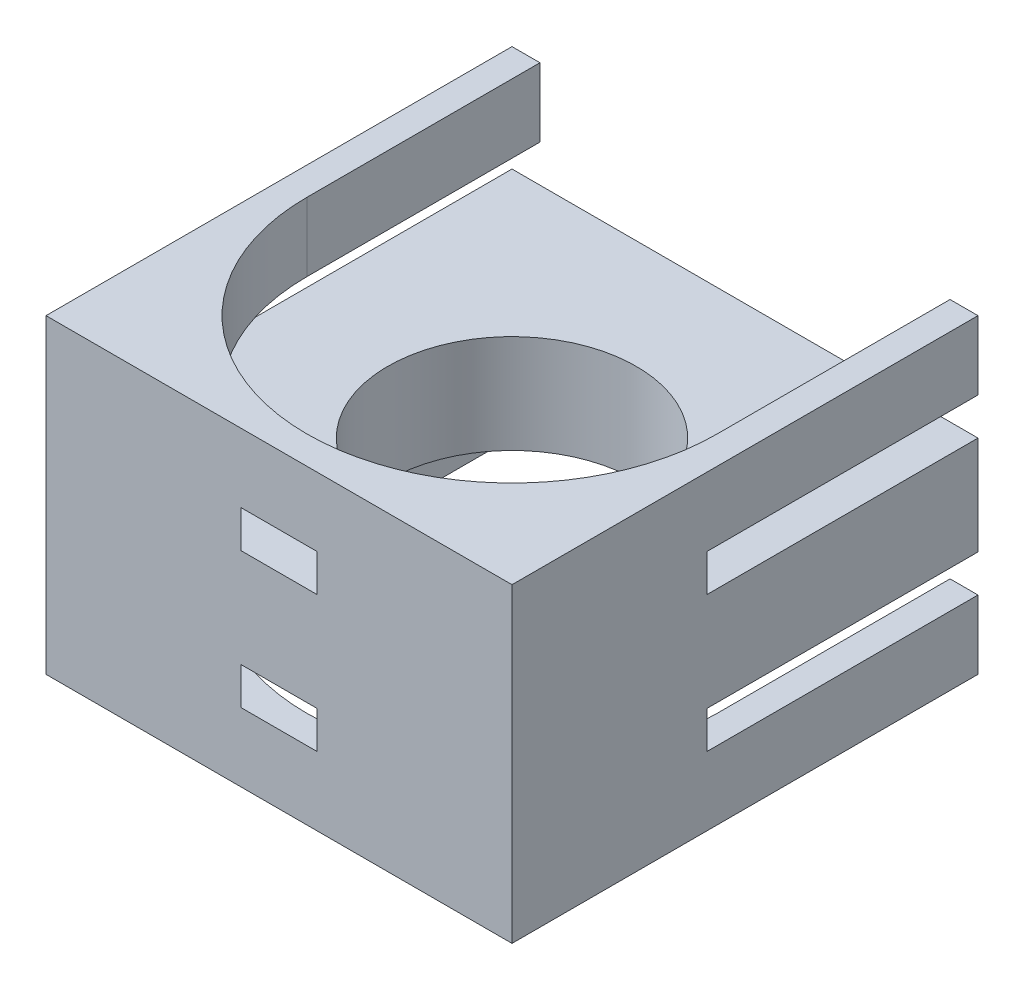
from build123d import *

# Parameters (mm, degrees)
SKETCH1_W           = 15
SKETCH1_H           = 15
BOSS_EXTRUDE1_DEPTH = 5
SKETCH2_W           = 15
SKETCH2_H           = 2.5
BOSS_EXTRUDE2_DEPTH = 15
CUT_EXTRUDE1_START  = -7.5
CUT_EXTRUDE1_DEPTH  = 31
SKETCH4_R           = 7.6
CUT_EXTRUDE2_DEPTH  = 1.2
SKETCH5_R           = 6.6
CUT_EXTRUDE3_DEPTH  = 23.2125
CUT_EXTRUDE4_START  = 1.2
SKETCH6_R           = 7.6
CUT_EXTRUDE4_DEPTH  = 1.2
SKETCH7_R           = 6.6
CUT_EXTRUDE5_DEPTH  = 23.2125
SKETCH8_R           = 4
CUT_EXTRUDE6_DEPTH  = 23.2125


with BuildPart() as part:
    # Sketch1 → Boss-Extrude1 (new body)
    with BuildSketch(Plane(origin=(0, 0, 0), x_dir=(1, 0, 0), z_dir=(0, 1, 0))):
        with Locations((7.5, -7.5)):
            Rectangle(SKETCH1_W, SKETCH1_H)
    extrude(amount=BOSS_EXTRUDE1_DEPTH)

    # Sketch2 → Boss-Extrude2 (add)
    with BuildSketch(Plane.XY.offset(15)):
        with Locations((7.5, 6.25)):
            Rectangle(SKETCH2_W, SKETCH2_H)
        with Locations((7.5, -1.25)):
            Rectangle(SKETCH2_W, SKETCH2_H)
    extrude(amount=-BOSS_EXTRUDE2_DEPTH)

    # Sketch3 → Cut-Extrude1 (cut)
    with BuildSketch(Plane(origin=(0, 0, 0), x_dir=(-1, 0, 0), z_dir=(0, 0, -1)).offset(CUT_EXTRUDE1_START)):
        Polygon((-14.1, 7.5), (-14.1, 5.2875), (-15.1, 5.2875), (-15.1, 4.0875), (-7.5, 4.0875), (0.1, 4.0875), (0.1, 5.2875), (-0.9, 5.2875), (-0.9, 7.5), align=None)
    cut_extrude1 = extrude(amount=CUT_EXTRUDE1_DEPTH, mode=Mode.SUBTRACT)

    # Sketch4 → Cut-Extrude2 (cut)
    with BuildSketch(Plane(origin=(0, 4.0875, 0), x_dir=(1, 0, 0), z_dir=(0, 1, 0))):
        with Locations((7.5, -7.5)):
            Circle(SKETCH4_R)
    extrude(amount=CUT_EXTRUDE2_DEPTH, mode=Mode.SUBTRACT)

    # Sketch5 → Cut-Extrude3 (cut, through all)
    with BuildSketch(Plane(origin=(0, 4.0875, 0), x_dir=(1, 0, 0), z_dir=(0, 1, 0))):
        with Locations((7.5, -7.5)):
            Circle(SKETCH5_R)
    extrude(amount=CUT_EXTRUDE3_DEPTH, mode=Mode.SUBTRACT)

    # Mirror1: Cut-Extrude1 across plane
    add(cut_extrude1.mirror(Plane(origin=(0, 2.5, 0), x_dir=(0, 0, 1), z_dir=(0, -1, 0))), mode=Mode.SUBTRACT)

    # Sketch6 → Cut-Extrude4 (cut)
    with BuildSketch(Plane.XZ.offset(-0.9125).offset(CUT_EXTRUDE4_START)):
        with Locations((7.5, 7.5)):
            Circle(SKETCH6_R)
    extrude(amount=-CUT_EXTRUDE4_DEPTH, mode=Mode.SUBTRACT)

    # Sketch7 → Cut-Extrude5 (cut, through all)
    with BuildSketch(Plane.XZ.offset(-0.9125)):
        with Locations((7.5, 7.5)):
            Circle(SKETCH7_R)
    extrude(amount=CUT_EXTRUDE5_DEPTH, mode=Mode.SUBTRACT)

    # Sketch8 → Cut-Extrude6 (cut, through all)
    with BuildSketch(Plane(origin=(0, 4.0875, 0), x_dir=(1, 0, 0), z_dir=(0, 1, 0))):
        with Locations(Location((7.5, -7.5, 0), (0, 0, 270))):
            Circle(SKETCH8_R)
    extrude(amount=-CUT_EXTRUDE6_DEPTH, mode=Mode.SUBTRACT)


solid = part.part
